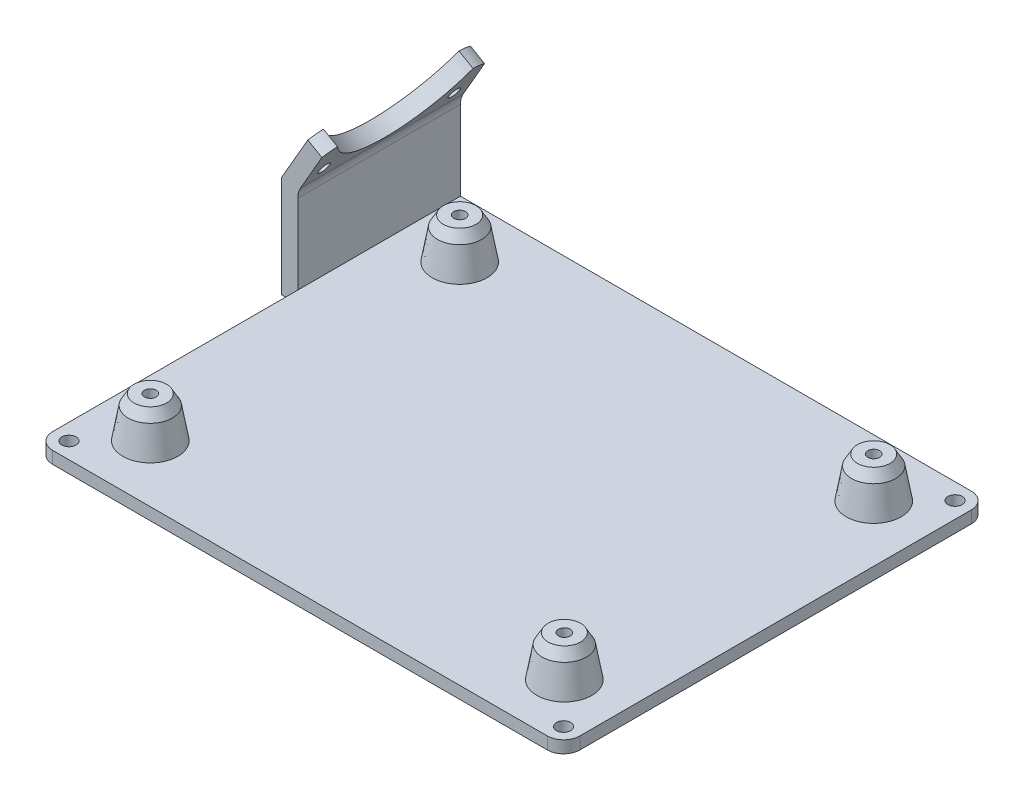
from build123d import *
from OCP.BRepFilletAPI import BRepFilletAPI_MakeChamfer

# Parameters (mm, degrees)
SKETCH2_R                     = 1.75
BOSS_EXTRUDE1_DEPTH           = 3
BOSS_EXTRUDE2_START           = 10
SKETCH3_R                     = 5
BOSS_EXTRUDE2_DEPTH           = 13
BOSS_EXTRUDE2_DRAFT           = 10
BOSS_EXTRUDE2_PROFILE_2_DEPTH = 13
BOSS_EXTRUDE2_PROFILE_2_DRAFT = 10
BOSS_EXTRUDE2_PROFILE_3_DEPTH = 13
BOSS_EXTRUDE2_PROFILE_3_DRAFT = 10
BOSS_EXTRUDE2_PROFILE_4_DEPTH = 13
BOSS_EXTRUDE2_PROFILE_4_DRAFT = 10
SKETCH4_R                     = 1.45
CUT_EXTRUDE1_DEPTH            = 85.215198895
CHAMFER1_SIZE                 = 1
CHAMFER1_SIZE2                = 2.532088886
SKETCH5_W                     = 40
SKETCH5_H                     = 25
BOSS_EXTRUDE3_DEPTH           = 4
BOSS_EXTRUDE4_DEPTH           = 3
BOSS_EXTRUDE5_DEPTH           = 40
SKETCH8_R                     = 1.4
CUT_EXTRUDE3_DEPTH            = 4
FILLET1_R                     = 5


with BuildPart() as part:
    # Sketch2 → Boss-Extrude1 (new body)
    with BuildSketch(Plane(origin=(0, 0, 0), x_dir=(1, 0, 0), z_dir=(0, 1, 0))):
        with BuildLine():
            Line((-64.835, 47.15), (-64.835, -48.15))
            ThreePointArc((-64.835, -48.15), (-63.663427125, -50.978427125), (-60.835, -52.15))
            Line((-60.835, -52.15), (60.835, -52.15))
            ThreePointArc((60.835, -52.15), (63.663427125, -50.978427125), (64.835, -48.15))
            Line((64.835, -48.15), (64.835, 48.15))
            ThreePointArc((64.835, 48.15), (63.663427125, 50.978427125), (60.835, 52.15))
            Line((60.835, 52.15), (-59.835, 52.15))
            ThreePointArc((-59.835, 52.15), (-63.370533906, 50.685533906), (-64.835, 47.15))
        make_face()
        with Locations(Location((-59.835, 47.15, 0), (0, 0, 270))):
            Circle(SKETCH2_R, mode=Mode.SUBTRACT)
        with Locations(Location((60.835, 48.15, 0), (0, 0, 270))):
            Circle(SKETCH2_R, mode=Mode.SUBTRACT)
        with Locations(Location((60.835, -48.15, 0), (0, 0, 270))):
            Circle(SKETCH2_R, mode=Mode.SUBTRACT)
        with Locations(Location((-60.835, -48.15, 0), (0, 0, 270))):
            Circle(SKETCH2_R, mode=Mode.SUBTRACT)
    extrude(amount=BOSS_EXTRUDE1_DEPTH)


with BuildPart() as boss_extrude2_tool:
    # Sketch3 → Boss-Extrude2 (with draft: the straight prism first)
    with BuildSketch(Plane(origin=(0, 3, 0), x_dir=(1, 0, 0), z_dir=(0, 1, 0)).offset(BOSS_EXTRUDE2_START)):
        with Locations((-50.925, 38.05)):
            Circle(SKETCH3_R)
    extrude(amount=-BOSS_EXTRUDE2_DEPTH)
    # Boss-Extrude2: the draft: its side faces are tilted about the plane it starts from
    boss_extrude2_sides = [boss_extrude2_tool.faces().sort_by_distance(p)[0] for p in [
        (-55.925, 6.5, -38.05),
    ]]
    draft(boss_extrude2_sides, Plane(origin=(0, 3, 0), x_dir=(1, 0, 0), z_dir=(0, 1, 0)).offset(BOSS_EXTRUDE2_START), BOSS_EXTRUDE2_DRAFT)


with BuildPart() as part_1:
    add(part.part)

    # Boss-Extrude2: add boss_extrude2_tool
    add(boss_extrude2_tool.part)


with BuildPart() as boss_extrude2_profile_2_tool:
    # Sketch3 → Boss-Extrude2 profile 2 (with draft: the straight prism first)
    with BuildSketch(Plane(origin=(0, 3, 0), x_dir=(1, 0, 0), z_dir=(0, 1, 0)).offset(BOSS_EXTRUDE2_START)):
        with Locations((50.925, 38.05)):
            Circle(SKETCH3_R)
    extrude(amount=-BOSS_EXTRUDE2_PROFILE_2_DEPTH)
    # Boss-Extrude2 profile 2: the draft: its side faces are tilted about the plane it starts from
    boss_extrude2_profile_2_sides = [boss_extrude2_profile_2_tool.faces().sort_by_distance(p)[0] for p in [
        (45.925, 6.5, -38.05),
    ]]
    draft(boss_extrude2_profile_2_sides, Plane(origin=(0, 3, 0), x_dir=(1, 0, 0), z_dir=(0, 1, 0)).offset(BOSS_EXTRUDE2_START), BOSS_EXTRUDE2_PROFILE_2_DRAFT)


with BuildPart() as part_2:
    add(part_1.part)

    # Boss-Extrude2 profile 2: add boss_extrude2_profile_2_tool
    add(boss_extrude2_profile_2_tool.part)


with BuildPart() as boss_extrude2_profile_3_tool:
    # Sketch3 → Boss-Extrude2 profile 3 (with draft: the straight prism first)
    with BuildSketch(Plane(origin=(0, 3, 0), x_dir=(1, 0, 0), z_dir=(0, 1, 0)).offset(BOSS_EXTRUDE2_START)):
        with Locations((-50.925, -38.05)):
            Circle(SKETCH3_R)
    extrude(amount=-BOSS_EXTRUDE2_PROFILE_3_DEPTH)
    # Boss-Extrude2 profile 3: the draft: its side faces are tilted about the plane it starts from
    boss_extrude2_profile_3_sides = [boss_extrude2_profile_3_tool.faces().sort_by_distance(p)[0] for p in [
        (-55.925, 6.5, 38.05),
    ]]
    draft(boss_extrude2_profile_3_sides, Plane(origin=(0, 3, 0), x_dir=(1, 0, 0), z_dir=(0, 1, 0)).offset(BOSS_EXTRUDE2_START), BOSS_EXTRUDE2_PROFILE_3_DRAFT)


with BuildPart() as part_3:
    add(part_2.part)

    # Boss-Extrude2 profile 3: add boss_extrude2_profile_3_tool
    add(boss_extrude2_profile_3_tool.part)


with BuildPart() as boss_extrude2_profile_4_tool:
    # Sketch3 → Boss-Extrude2 profile 4 (with draft: the straight prism first)
    with BuildSketch(Plane(origin=(0, 3, 0), x_dir=(1, 0, 0), z_dir=(0, 1, 0)).offset(BOSS_EXTRUDE2_START)):
        with Locations((50.925, -38.05)):
            Circle(SKETCH3_R)
    extrude(amount=-BOSS_EXTRUDE2_PROFILE_4_DEPTH)
    # Boss-Extrude2 profile 4: the draft: its side faces are tilted about the plane it starts from
    boss_extrude2_profile_4_sides = [boss_extrude2_profile_4_tool.faces().sort_by_distance(p)[0] for p in [
        (45.925, 6.5, 38.05),
    ]]
    draft(boss_extrude2_profile_4_sides, Plane(origin=(0, 3, 0), x_dir=(1, 0, 0), z_dir=(0, 1, 0)).offset(BOSS_EXTRUDE2_START), BOSS_EXTRUDE2_PROFILE_4_DRAFT)


with BuildPart() as part_4:
    add(part_3.part)

    # Boss-Extrude2 profile 4: add boss_extrude2_profile_4_tool
    add(boss_extrude2_profile_4_tool.part)

    # Sketch4 → Cut-Extrude1 (cut, through all)
    with BuildSketch(Plane(origin=(0, 13, 0), x_dir=(1, 0, 0), z_dir=(0, 1, 0))):
        with Locations(Location((-50.925, 38.05, 0), (0, 0, 270))):
            Circle(SKETCH4_R)
        with Locations(Location((50.925, 38.05, 0), (0, 0, 270))):
            Circle(SKETCH4_R)
        with Locations(Location((50.925, -38.05, 0), (0, 0, 270))):
            Circle(SKETCH4_R)
        with Locations(Location((-50.925, -38.05, 0), (0, 0, 270))):
            Circle(SKETCH4_R)
    extrude(amount=-CUT_EXTRUDE1_DEPTH, mode=Mode.SUBTRACT)

    # Chamfer1: one chamfer whose edges measure the first distance from different faces: ONE call of the kernel's chamfer builder (chamfer() names one face for all edges)
    chamfer1_edges_1 = [part_4.edges().sort_by_distance(p)[0] for p in [
        (-55.925, 13, -38.05),
    ]]
    chamfer1_side_1 = [part_4.faces().sort_by_distance(p)[0] for p in [
        (-55.783578644, 13, -38.05),
    ]]
    chamfer1_edges_2 = [part_4.edges().sort_by_distance(p)[0] for p in [
        (45.925, 13, -38.05),
    ]]
    chamfer1_side_2 = [part_4.faces().sort_by_distance(p)[0] for p in [
        (46.066421356, 13, -38.05),
    ]]
    chamfer1_edges_3 = [part_4.edges().sort_by_distance(p)[0] for p in [
        (-55.925, 13, 38.05),
    ]]
    chamfer1_side_3 = [part_4.faces().sort_by_distance(p)[0] for p in [
        (-55.783578644, 13, 38.05),
    ]]
    chamfer1_edges_4 = [part_4.edges().sort_by_distance(p)[0] for p in [
        (45.925, 13, 38.05),
    ]]
    chamfer1_side_4 = [part_4.faces().sort_by_distance(p)[0] for p in [
        (46.066421356, 13, 38.05),
    ]]
    chamfer1 = BRepFilletAPI_MakeChamfer(part_4.part.solid().wrapped)
    for e in chamfer1_edges_1:
        chamfer1.Add(CHAMFER1_SIZE, CHAMFER1_SIZE2, e.wrapped, chamfer1_side_1[0].wrapped)  # the first distance lies on this face
    for e in chamfer1_edges_2:
        chamfer1.Add(CHAMFER1_SIZE, CHAMFER1_SIZE2, e.wrapped, chamfer1_side_2[0].wrapped)  # the first distance lies on this face
    for e in chamfer1_edges_3:
        chamfer1.Add(CHAMFER1_SIZE, CHAMFER1_SIZE2, e.wrapped, chamfer1_side_3[0].wrapped)  # the first distance lies on this face
    for e in chamfer1_edges_4:
        chamfer1.Add(CHAMFER1_SIZE, CHAMFER1_SIZE2, e.wrapped, chamfer1_side_4[0].wrapped)  # the first distance lies on this face
    add(Compound.cast(chamfer1.Shape()), mode=Mode.REPLACE)

    # Sketch5 → Boss-Extrude3 (add)
    with BuildSketch(Plane.ZY.offset(64.835)):
        with Locations((-32.15, 12.5)):
            Rectangle(SKETCH5_W, SKETCH5_H)
    extrude(amount=BOSS_EXTRUDE3_DEPTH)

    # Sketch6 → Boss-Extrude4 (add)
    with BuildSketch(Plane.XZ):
        with BuildLine():
            Line((-59.835, -52.15), (-64.835, -52.15))
            Line((-64.835, -52.15), (-64.835, -47.15))
            ThreePointArc((-64.835, -47.15), (-63.370533906, -50.685533906), (-59.835, -52.15))
        make_face()
    extrude(amount=-BOSS_EXTRUDE4_DEPTH)

    # Sketch7 → Boss-Extrude5 (add)
    with BuildSketch(Plane(origin=(0, 0, -52.15), x_dir=(-1, 0, 0), z_dir=(0, 0, -1))):
        Polygon((52.604700032, 45.111704166), (64.835, 23.92820323), (64.835, 25), (68.835, 25), (56.068801648, 47.111704166), align=None)
    extrude(amount=-BOSS_EXTRUDE5_DEPTH)

    # Sketch8 → Cut-Extrude3 (cut)
    with BuildSketch(Plane(origin=(-62.451567547, 36.056429335, 0), x_dir=(0, 0, 1), z_dir=(-0.866025403784438, 0.5000000000000011, 0))):
        with BuildLine():
            Line((-50.309630324, 12.765531799), (-52.15, 12.765531799))
            Line((-52.15, 12.765531799), (-52.15, 0.161338325))
            ThreePointArc((-52.15, 0.161338325), (-50.541368872, 0.867357709), (-48.817423041, 1.205245636))
            ThreePointArc((-48.817423041, 1.205245636), (-50.497778219, 6.864795081), (-50.309630324, 12.765531799))
        make_face()
        with BuildLine():
            Line((-13.990369676, 12.765531799), (-50.309630324, 12.765531799))
            ThreePointArc((-50.309630324, 12.765531799), (-50.497778219, 6.864795081), (-48.817423041, 1.205245636))
            ThreePointArc((-48.817423041, 1.205245636), (-32.15, -9.266864905), (-15.482576959, 1.205245636))
            ThreePointArc((-15.482576959, 1.205245636), (-14.1139621, 5.11593497), (-13.65, 9.233135095))
            ThreePointArc((-13.65, 9.233135095), (-13.735289019, 11.007513718), (-13.990369676, 12.765531799))
        make_face()
        with BuildLine():
            ThreePointArc((-13.990369676, 12.765531799), (-32.15, 27.733135095), (-50.309630324, 12.765531799))
            Line((-50.309630324, 12.765531799), (-13.990369676, 12.765531799))
        make_face()
        with BuildLine():
            Line((-12.15, 12.765531799), (-13.990369676, 12.765531799))
            ThreePointArc((-13.990369676, 12.765531799), (-13.735289019, 11.007513718), (-13.65, 9.233135095))
            ThreePointArc((-13.65, 9.233135095), (-14.1139621, 5.11593497), (-15.482576959, 1.205245636))
            ThreePointArc((-15.482576959, 1.205245636), (-13.758631128, 0.867357709), (-12.15, 0.161338325))
            Line((-12.15, 0.161338325), (-12.15, 12.765531799))
        make_face()
        with Locations(Location((-16.15, -6.766864905, 0), (0, 0, 270))):
            Circle(SKETCH8_R)
        with Locations(Location((-48.15, -6.766864905, 0), (0, 0, 270))):
            Circle(SKETCH8_R)
    extrude(amount=-CUT_EXTRUDE3_DEPTH, mode=Mode.SUBTRACT)

    # Fillet1
    fillet1_edges = [part_4.edges().sort_by_distance(p)[0] for p in [
        (-64.835, 23.92820323, -32.15),
    ]]
    fillet(fillet1_edges, radius=FILLET1_R)


solid = part_4.part
